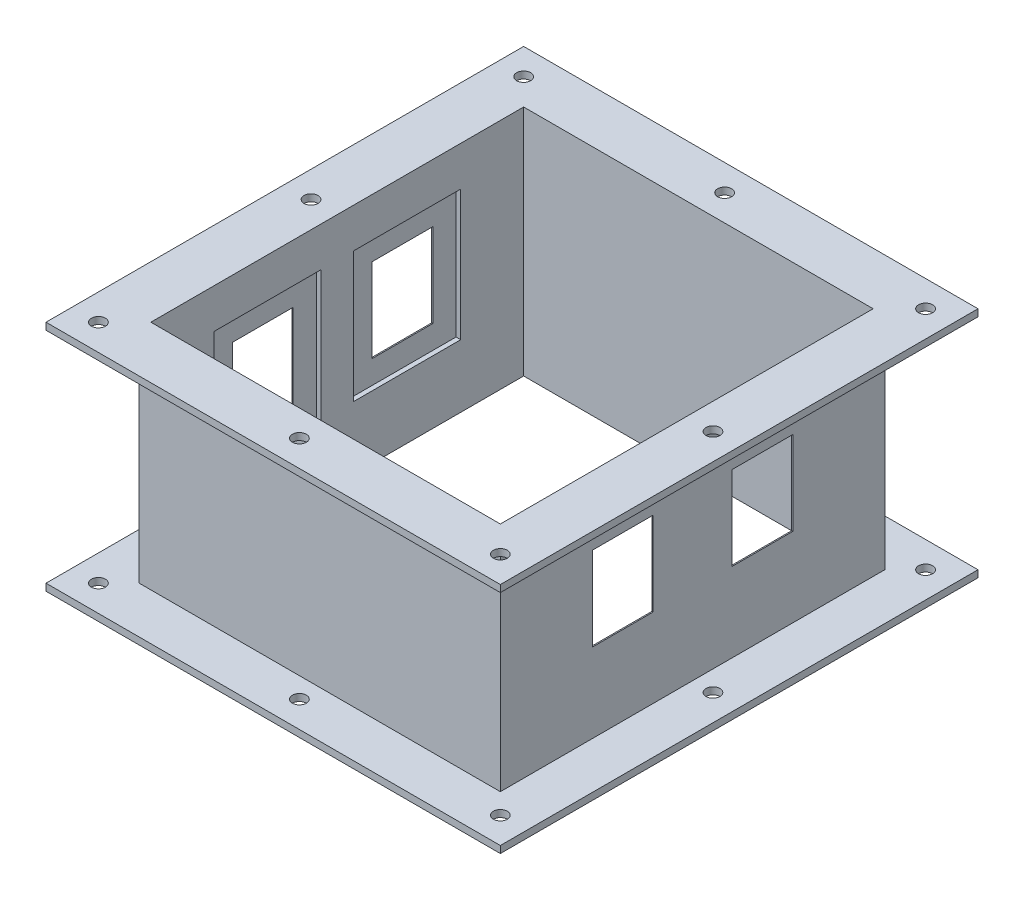
from build123d import *

# Parameters (mm, degrees)
SKETCH1_W           = 155
SKETCH1_H           = 165
SKETCH1_W_2         = 150
SKETCH1_H_2         = 160
BOSS_EXTRUDE1_DEPTH = 50
SKETCH2_W           = 26
SKETCH2_H           = 36
CUT_EXTRUDE1_DEPTH  = 183.568480303
CUT_EXTRUDE2_START  = -2
SKETCH3_W           = 46
SKETCH3_H           = 56
CUT_EXTRUDE2_DEPTH  = 154
SKETCH4_W           = 195
SKETCH4_H           = 205
SKETCH4_W_2         = 155
SKETCH4_H_2         = 165
BOSS_EXTRUDE2_DEPTH = 3
BOSS_EXTRUDE3_START = -100
SKETCH4_2_W         = 195
SKETCH4_2_H         = 205
SKETCH4_2_W_2       = 155
SKETCH4_2_H_2       = 165
BOSS_EXTRUDE3_DEPTH = 3
SKETCH5_R           = 3
CUT_EXTRUDE3_DEPTH  = 174.241161391


with BuildPart() as part:
    # Sketch1 → Boss-Extrude1 (new, symmetric)
    with BuildSketch(Plane(origin=(0, 0, 0), x_dir=(1, 0, 0), z_dir=(0, 1, 0))):
        Rectangle(SKETCH1_W, SKETCH1_H)
        Rectangle(SKETCH1_W_2, SKETCH1_H_2, mode=Mode.SUBTRACT)
    extrude(amount=BOSS_EXTRUDE1_DEPTH, both=True)

    # Sketch2 → Cut-Extrude1 (cut, through all)
    with BuildSketch(Plane(origin=(77.5, 0, 0), x_dir=(0, 0, -1), z_dir=(1, 0, 0))):
        with Locations((-30, 5)):
            Rectangle(SKETCH2_W, SKETCH2_H)
        with Locations((30, 5)):
            Rectangle(SKETCH2_W, SKETCH2_H)
    extrude(amount=-CUT_EXTRUDE1_DEPTH, mode=Mode.SUBTRACT)

    # Sketch3 → Cut-Extrude2 (cut)
    with BuildSketch(Plane.ZY.offset(-75).offset(CUT_EXTRUDE2_START)):
        with Locations((-30, 5)):
            Rectangle(SKETCH3_W, SKETCH3_H)
        with Locations((30, 5)):
            Rectangle(SKETCH3_W, SKETCH3_H)
    extrude(amount=CUT_EXTRUDE2_DEPTH, mode=Mode.SUBTRACT)

    # Sketch4 → Boss-Extrude2 (add)
    with BuildSketch(Plane(origin=(0, 50, 0), x_dir=(1, 0, 0), z_dir=(0, 1, 0))):
        Rectangle(SKETCH4_W, SKETCH4_H)
        Rectangle(SKETCH4_W_2, SKETCH4_H_2, mode=Mode.SUBTRACT)
    extrude(amount=-BOSS_EXTRUDE2_DEPTH)

    # Sketch4<2> → Boss-Extrude3 (add)
    with BuildSketch(Plane(origin=(0, 50, 0), x_dir=(1, 0, 0), z_dir=(0, 1, 0)).offset(BOSS_EXTRUDE3_START)):
        Rectangle(SKETCH4_2_W, SKETCH4_2_H)
        Rectangle(SKETCH4_2_W_2, SKETCH4_2_H_2, mode=Mode.SUBTRACT)
    extrude(amount=BOSS_EXTRUDE3_DEPTH)

    # Sketch5 → Cut-Extrude3 (cut, through all)
    with BuildSketch(Plane(origin=(0, 50, 0), x_dir=(1, 0, 0), z_dir=(0, 1, 0))):
        with Locations(Location((-86.25, 91.25, 0), (0, 0, 270))):
            Circle(SKETCH5_R)
        with Locations(Location((0, 91.25, 0), (0, 0, 270))):
            Circle(SKETCH5_R)
        with Locations(Location((86.25, 91.25, 0), (0, 0, 270))):
            Circle(SKETCH5_R)
        with Locations(Location((-86.25, 0, 0), (0, 0, 270))):
            Circle(SKETCH5_R)
        with Locations(Location((86.25, 0, 0), (0, 0, 270))):
            Circle(SKETCH5_R)
        with Locations(Location((86.25, -91.25, 0), (0, 0, 270))):
            Circle(SKETCH5_R)
        with Locations(Location((0, -91.25, 0), (0, 0, 270))):
            Circle(SKETCH5_R)
        with Locations(Location((-86.25, -91.25, 0), (0, 0, 270))):
            Circle(SKETCH5_R)
    extrude(amount=-CUT_EXTRUDE3_DEPTH, mode=Mode.SUBTRACT)


solid = part.part
